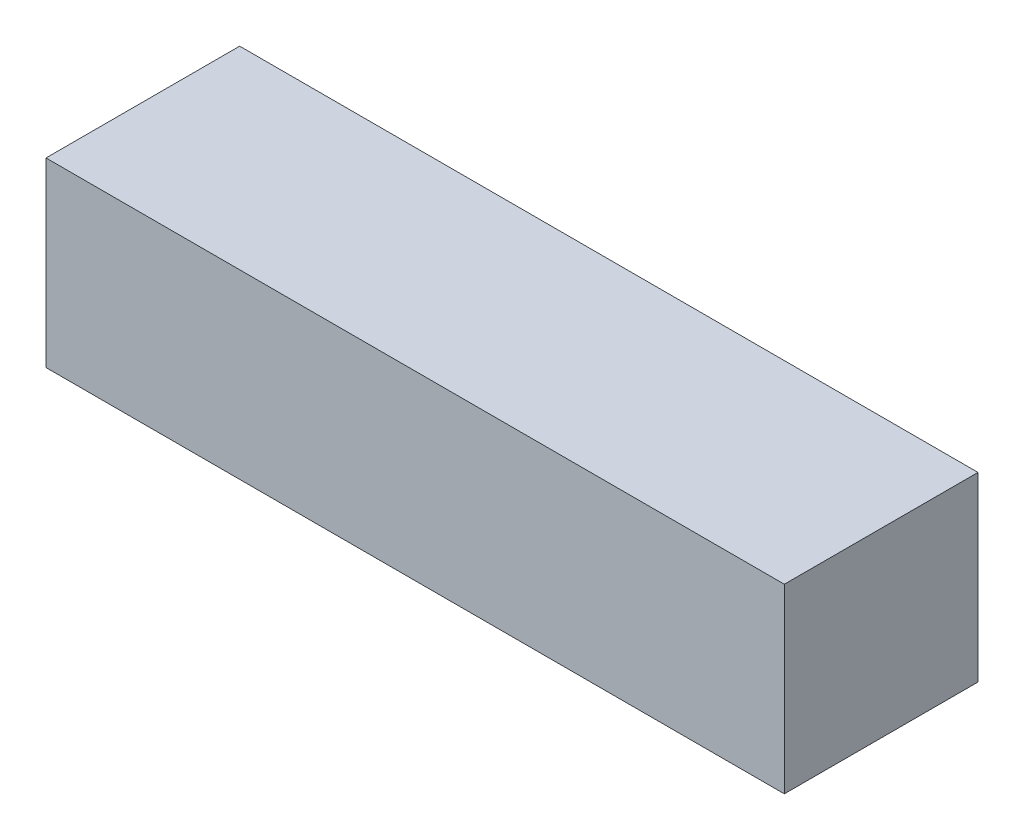
from build123d import *

# Parameters (mm, degrees)
SKETCH1_W           = 61
SKETCH1_H           = 16
BOSS_EXTRUDE1_DEPTH = 7.5


with BuildPart() as part:
    # Sketch1 → Boss-Extrude1 (new, symmetric)
    with BuildSketch(Plane(origin=(0, 0, 0), x_dir=(1, 0, 0), z_dir=(0, 1, 0))):
        Rectangle(SKETCH1_W, SKETCH1_H)
    extrude(amount=BOSS_EXTRUDE1_DEPTH, both=True)


solid = part.part
